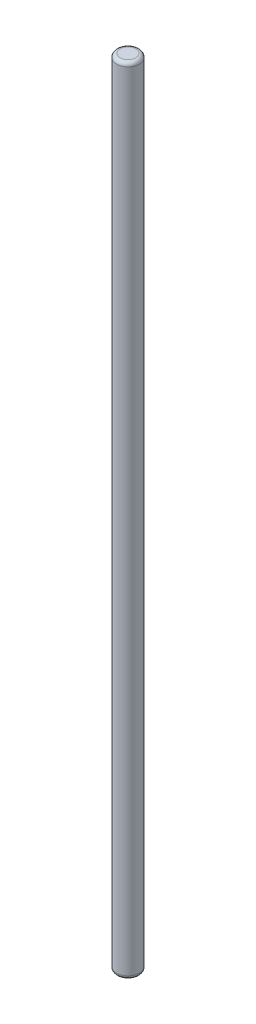
from build123d import *

# Parameters (mm, degrees)
SKETCH1_R           = 2.38125
BOSS_EXTRUDE1_DEPTH = 165.1
FILLET1_R           = 0.762


with BuildPart() as part:
    # Sketch1 → Boss-Extrude1 (new body)
    with BuildSketch(Plane(origin=(0, 0, 0), x_dir=(1, 0, 0), z_dir=(0, 1, 0))):
        with Locations(Location((0, 0, 0), (0, 0, 270))):
            Circle(SKETCH1_R)
    extrude(amount=BOSS_EXTRUDE1_DEPTH)

    # Fillet1
    fillet1_edges = [part.edges().sort_by_distance(p)[0] for p in [
        (0, 0, -2.38125),
        (0, 165.1, -2.38125),
    ]]
    fillet(fillet1_edges, radius=FILLET1_R)


solid = part.part
